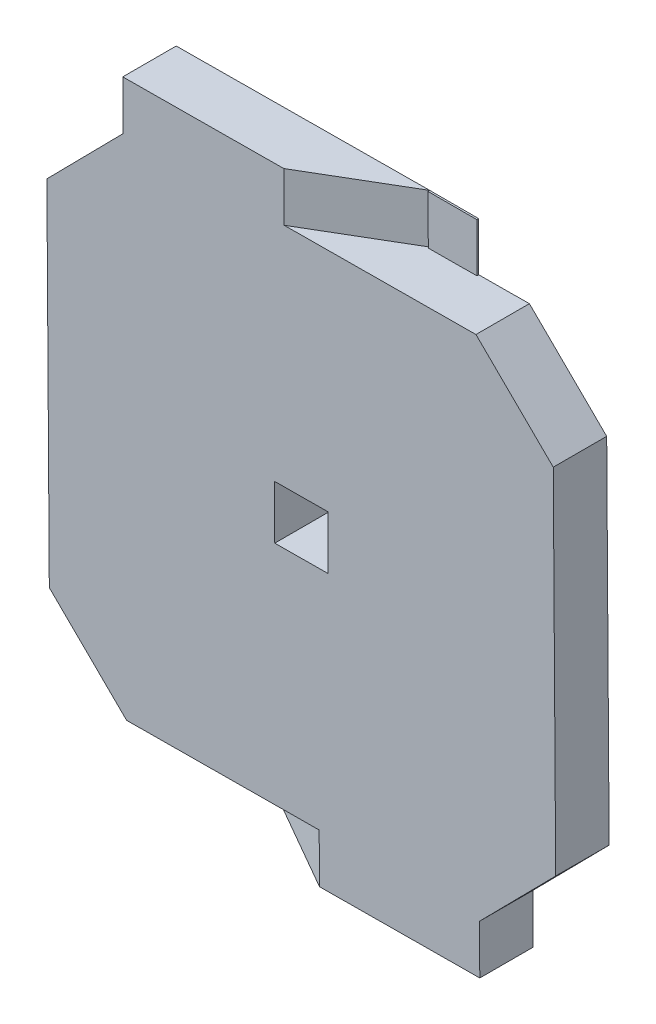
from build123d import *

# Parameters (mm, degrees)
BOSS_EXTRUDE1_DEPTH    = 600
BOSS_EXTRUDE2_DEPTH    = 550
BOSS_EXTRUDE4_DEPTH    = 550
BOSS_EXTRUDE15_DEPTH   = 20
BOSS_EXTRUDE15_2_DEPTH = 20
CUT_EXTRUDE1_DEPTH     = 1000


with BuildPart() as part:
    # Sketch6 → Boss-Extrude1 (new body)
    with BuildSketch(Plane.XY):
        Polygon((2687.662150109, -1666.76457761), (2660.34067182, 2295.63542239), (1792.312348512, 3151.775288262), (-2170.087651488, 3124.453809972), (-3026.22751736, 2256.425486664), (-2998.906039071, -1705.974513336), (-2130.877715762, -2562.114379207), (1831.522284238, -2534.792900918), align=None)
    extrude(amount=BOSS_EXTRUDE1_DEPTH)

    # Sketch7 → Boss-Extrude2 (add)
    with BuildSketch(Plane(origin=(-21.645829458, 3139.267712303, 0), x_dir=(0.9999762290643144, 0.0068950203998148505, 0), z_dir=(-0.0068950203998148505, 0.9999762290643144, 0))):
        Polygon((698.781298478, 0), (-340.449186063, -600), (-2148.492893716, -600), (-2148.492893716, 0), align=None)
    extrude(amount=BOSS_EXTRUDE2_DEPTH)

    # Sketch10 → Boss-Extrude4 (add)
    with BuildSketch(Plane(origin=(17.564106268, -2547.300476876, 0), x_dir=(0.9999762290643144, 0.006895020399814854, 0), z_dir=(0.006895020399814854, -0.9999762290643144, 0))):
        Polygon((1814.001298478, 600), (14.001298478, 600), (-1025.229186063, 0), (1814.001298478, 0), align=None)
    extrude(amount=BOSS_EXTRUDE4_DEPTH)

    # Sketch22 → Cut-Extrude1 (cut)
    with BuildSketch(Plane.XY.offset(600)):
        Polygon((128.641678954, 596.891829386), (-471.344058485, 592.754817146), (-467.207046245, -7.230920292), (132.778691194, -3.093908052), align=None)
    extrude(amount=-CUT_EXTRUDE1_DEPTH, mode=Mode.SUBTRACT)


with BuildPart() as body_2:
    # Sketch18 → Boss-Extrude15 (new body)
    with BuildSketch(Plane(origin=(0, 0, 0), x_dir=(-1, 0, 0), z_dir=(0, 0, -1))):
        Polygon((-677.118858334, 3144.085823612), (-673.326597115, 3694.072749597), (-1223.326597115, 3694.072749597), (-1223.326597115, 3147.852026639), align=None)
    extrude(amount=-BOSS_EXTRUDE15_DEPTH)


with BuildPart() as body_3:
    # Sketch18 → Boss-Extrude15 2 (new body)
    with BuildSketch(Plane(origin=(0, 0, 0), x_dir=(-1, 0, 0), z_dir=(0, 0, -1))):
        Polygon((1007.640709138, -2554.369453029), (1003.848447918, -3104.356379014), (1553.848447918, -3108.148730382), (1553.848447918, -2558.135656056), align=None)
    extrude(amount=-BOSS_EXTRUDE15_2_DEPTH)


solid = Compound([part.part, body_2.part, body_3.part])
